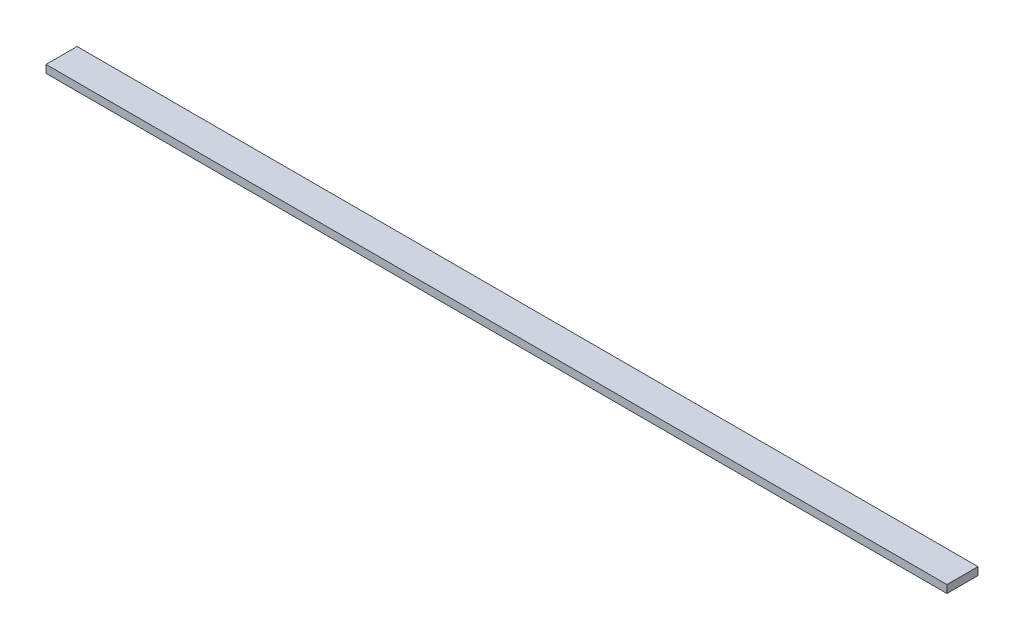
from build123d import *

# Parameters (mm, degrees)
SKETCH1_W           = 184.15
SKETCH1_H           = 6.35
BOSS_EXTRUDE1_DEPTH = 1.5875


with BuildPart() as part:
    # Sketch1 → Boss-Extrude1 (new body)
    with BuildSketch(Plane(origin=(0, 0, 0), x_dir=(1, 0, 0), z_dir=(0, 1, 0))):
        Rectangle(SKETCH1_W, SKETCH1_H)
    extrude(amount=BOSS_EXTRUDE1_DEPTH)


solid = part.part
